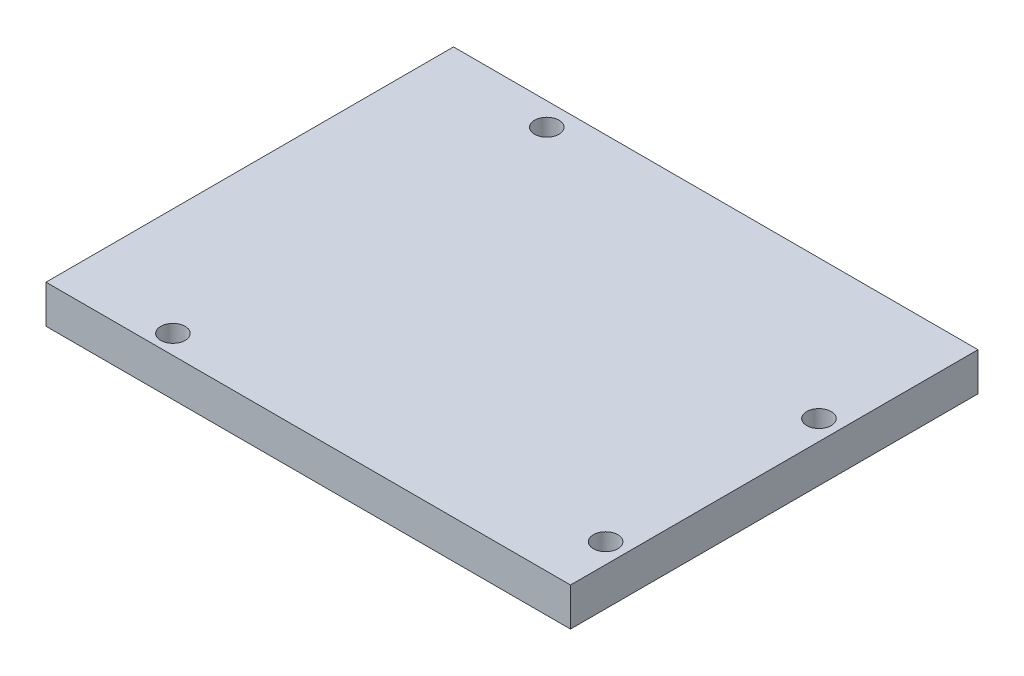
from build123d import *

# Parameters (mm, degrees)
CROQUIS1_W              = 68.6
CROQUIS1_H              = 53.3
CROQUIS1_R              = 1.6
SALIENTE_EXTRUIR1_DEPTH = 5


with BuildPart() as part:
    # Croquis1 → Saliente-Extruir1 (new body)
    with BuildSketch(Plane(origin=(0, 0, 0), x_dir=(1, 0, 0), z_dir=(0, 1, 0))):
        with Locations((-1.22768329, 1.023069409)):
            Rectangle(CROQUIS1_W, CROQUIS1_H)
        with Locations(Location((30.47231671, -18.426930591, 0), (0, 0, 270))):
            Circle(CROQUIS1_R, mode=Mode.SUBTRACT)
        with Locations(Location((30.47231671, 9.473069409, 0), (0, 0, 270))):
            Circle(CROQUIS1_R, mode=Mode.SUBTRACT)
        with Locations(Location((-20.32768329, 24.673069409, 0), (0, 0, 270))):
            Circle(CROQUIS1_R, mode=Mode.SUBTRACT)
        with Locations(Location((-21.42768329, -23.126930591, 0), (0, 0, 270))):
            Circle(CROQUIS1_R, mode=Mode.SUBTRACT)
    extrude(amount=SALIENTE_EXTRUIR1_DEPTH)


solid = part.part
